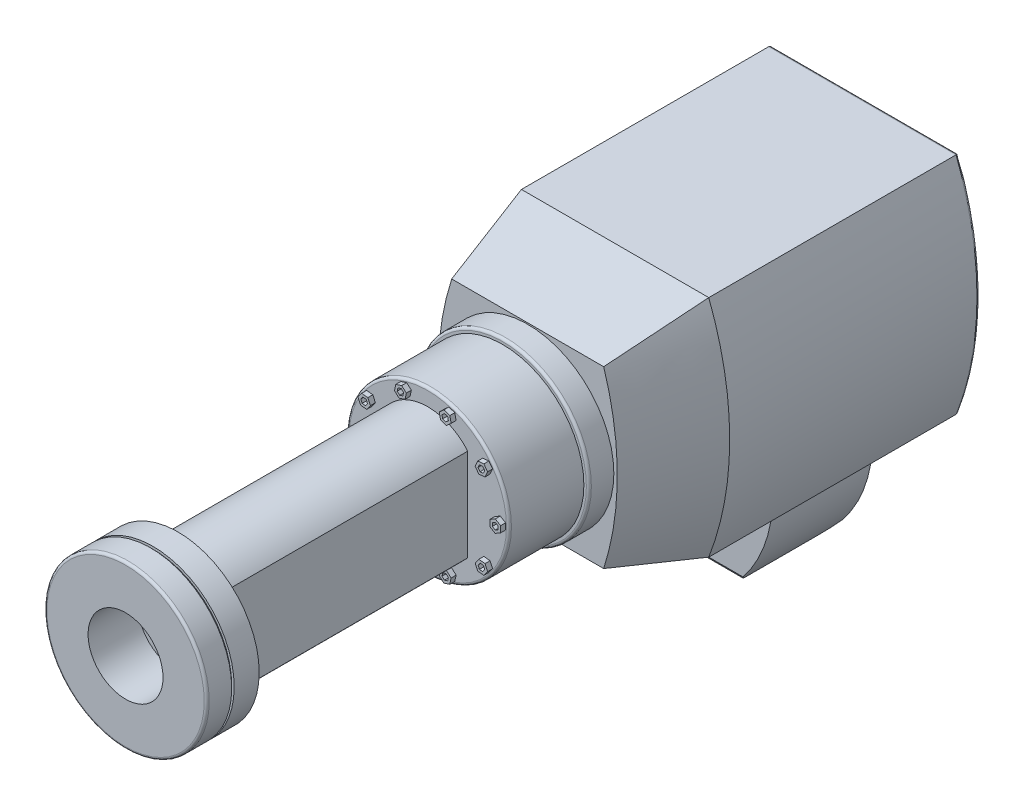
from build123d import *

# Parameters (mm, degrees)
BOSS_EXTRUDE1_DEPTH  = 100
SKETCH4_R            = 34.5
BOSS_EXTRUDE2_DEPTH  = 10
SKETCH5_R            = 32.5
BOSS_EXTRUDE3_DEPTH  = 30
BOSS_EXTRUDE4_DEPTH  = 2
CIRPATTERN1_COUNT    = 10
BOSS_EXTRUDE5_DEPTH  = 100
SKETCH8_R            = 32.5
BOSS_EXTRUDE6_DEPTH  = 10
SKETCH9_R            = 31.5
BOSS_EXTRUDE7_DEPTH  = 1
SKETCH10_R           = 32.5
BOSS_EXTRUDE8_DEPTH  = 10
SKETCH11_R           = 42.5
BOSS_EXTRUDE9_DEPTH  = 10.5
BOSS_EXTRUDE10_DEPTH = 35
BOSS_EXTRUDE11_DEPTH = 20
CUT_EXTRUDE1_DEPTH   = 314.700892617
FILLET1_R            = 1
SKETCH15_R           = 15
CUT_EXTRUDE3_DEPTH   = 20
SKETCH17_R           = 15
CUT_EXTRUDE5_DEPTH   = 20


with BuildPart() as part:
    # Sketch1 → Boss-Extrude1 (new body)
    with BuildSketch(Plane.XY):
        with BuildLine():
            Line((-37.5, 45), (37.5, 45))
            ThreePointArc((37.5, 45), (45.880962103, 0), (37.5, -45))
            Line((37.5, -45), (-37.5, -45))
            ThreePointArc((-37.5, -45), (-45.880962103, 0), (-37.5, 45))
        make_face()
    extrude(amount=BOSS_EXTRUDE1_DEPTH)

    # Sketch3 → section 1 of loft1
    with BuildSketch(Plane.XY.offset(135), mode=Mode.PRIVATE) as loft1_s1:
        with BuildLine():
            Line((30.425473604, 35), (-30.425473604, 35))
            ThreePointArc((-30.425473604, 35), (-35.880962103, 0), (-30.425473604, -35))
            Line((-30.425473604, -35), (30.425473604, -35))
            ThreePointArc((30.425473604, -35), (35.880962103, 0), (30.425473604, 35))
        make_face()
    # loft from a face of the part (loft1)
    loft([part.faces().sort_by_distance((0, 0, 100))[0], loft1_s1.sketch])

    # Sketch4 → Boss-Extrude2 (add)
    with BuildSketch(Plane.XY.offset(135)):
        Circle(SKETCH4_R)
    extrude(amount=BOSS_EXTRUDE2_DEPTH)

    # Sketch5 → Boss-Extrude3 (add)
    with BuildSketch(Plane.XY.offset(145)):
        Circle(SKETCH5_R)
    extrude(amount=BOSS_EXTRUDE3_DEPTH)

    # Sketch6 → Boss-Extrude4 (add)
    with BuildSketch(Plane.XY.offset(175)):
        Polygon((29, 2.5), (26.834936491, 1.25), (26.834936491, -1.25), (29, -2.5), (31.165063509, -1.25), (31.165063509, 1.25), align=None)
        Polygon((29, 1.345299462), (27.834936491, 0.672649731), (27.834936491, -0.672649731), (29, -1.345299462), (30.165063509, -0.672649731), (30.165063509, 0.672649731), align=None, mode=Mode.SUBTRACT)
    boss_extrude4 = extrude(amount=BOSS_EXTRUDE4_DEPTH)

    # CirPattern1: Boss-Extrude4 ×10 about axis
    cirpattern1_axis = Axis((0, 0, 0), (0, 0, 1))
    for i in range(1, CIRPATTERN1_COUNT):
        add(boss_extrude4.rotate(cirpattern1_axis, i * 360 / CIRPATTERN1_COUNT))

    # Sketch7 → Boss-Extrude5 (add)
    with BuildSketch(Plane.XY.offset(175)):
        with BuildLine():
            Line((16, -18.5), (16, 18.5))
            ThreePointArc((16, 18.5), (0, 25.898529491), (-16, 18.5))
            Line((-16, 18.5), (-16, -18.5))
            ThreePointArc((-16, -18.5), (0, -25.898529491), (16, -18.5))
        make_face()
    extrude(amount=BOSS_EXTRUDE5_DEPTH)

    # Sketch8 → Boss-Extrude6 (add)
    with BuildSketch(Plane.XY.offset(275)):
        Circle(SKETCH8_R)
    extrude(amount=BOSS_EXTRUDE6_DEPTH)

    # Sketch9 → Boss-Extrude7 (add)
    with BuildSketch(Plane.XY.offset(285)):
        Circle(SKETCH9_R)
    extrude(amount=BOSS_EXTRUDE7_DEPTH)

    # Sketch10 → Boss-Extrude8 (add)
    with BuildSketch(Plane.XY.offset(286)):
        Circle(SKETCH10_R)
    extrude(amount=BOSS_EXTRUDE8_DEPTH)

    # Sketch11 → Boss-Extrude9 (add, symmetric)
    with BuildSketch(Plane(origin=(-37.5, 0, 0), x_dir=(0, 0, -1), z_dir=(1, 0, 0))):
        with Locations((-50, -45)):
            Circle(SKETCH11_R)
    extrude(amount=BOSS_EXTRUDE9_DEPTH, both=True)

    # Sketch12 → Boss-Extrude10 (add)
    with BuildSketch(Plane(origin=(-27, 0, 0), x_dir=(0, 0, -1), z_dir=(1, 0, 0))):
        with BuildLine():
            Line((-70, -45), (-70, -75))
            ThreePointArc((-70, -75), (-50, -85.128852225), (-30, -75))
            Line((-30, -75), (-30, -45))
            Line((-30, -45), (-70, -45))
        make_face()
    extrude(amount=BOSS_EXTRUDE10_DEPTH)

    # Sketch13 → Boss-Extrude11 (add, symmetric)
    with BuildSketch(Plane.XY.offset(50)):
        with BuildLine():
            Line((8, -87), (8, -45))
            Line((8, -45), (33, -45))
            ThreePointArc((33, -45), (25.421855105, -68.929675658), (8, -87))
        make_face()
    extrude(amount=BOSS_EXTRUDE11_DEPTH, both=True)

    # Sketch14 → Cut-Extrude1 (cut, through all)
    with BuildSketch(Plane.ZY.offset(-8)):
        with BuildLine():
            Line((70, -87), (70, -75))
            ThreePointArc((70, -75), (50, -85.128852225), (30, -75))
            Line((30, -75), (30, -87))
            Line((30, -87), (70, -87))
        make_face()
    extrude(amount=-CUT_EXTRUDE1_DEPTH, mode=Mode.SUBTRACT)

    # Fillet1
    fillet1_edges = [part.edges().sort_by_distance(p)[0] for p in [
        (-34.5, 0, 145),
        (-32.5, 0, 175),
        (-32.5, 0, 296),
        (-48, -45, 92.5),
        (-27, -87.5, 50),
        (0, -45, 0),
        (-45.880962103, 0, 0),
        (0, 45, 0),
        (45.880962103, 0, 0),
    ]]
    fillet(fillet1_edges, radius=FILLET1_R)

    # Sketch15 → Cut-Extrude3 (cut)
    with BuildSketch(Plane.XY.offset(296)):
        Circle(SKETCH15_R)
    extrude(amount=-CUT_EXTRUDE3_DEPTH, mode=Mode.SUBTRACT)

    # Sketch17 → Cut-Extrude5 (cut)
    with BuildSketch(Plane.ZY.offset(48)):
        with Locations((50, -45)):
            Circle(SKETCH17_R)
    extrude(amount=-CUT_EXTRUDE5_DEPTH, mode=Mode.SUBTRACT)


solid = part.part
